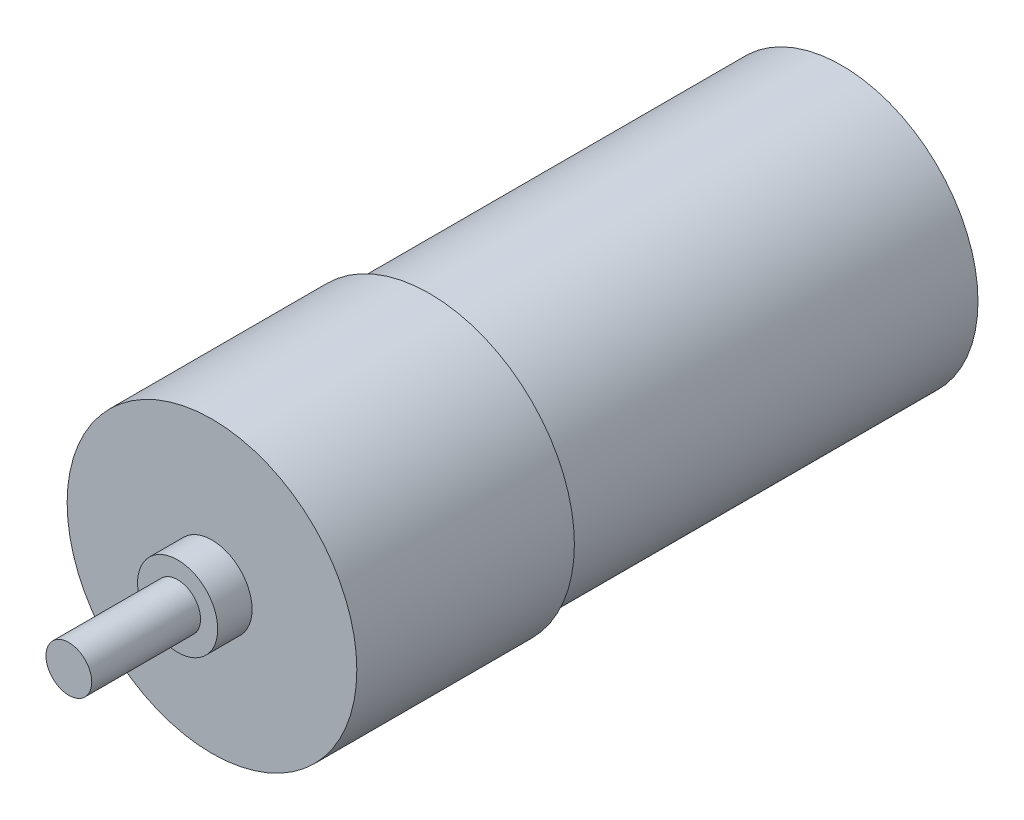
from build123d import *

# Parameters (mm, degrees)
SKETCH1_R           = 11.9
BOSS_EXTRUDE1_DEPTH = 36
SKETCH2_R           = 12.65
BOSS_EXTRUDE2_DEPTH = 19
SKETCH3_R           = 3.5
BOSS_EXTRUDE3_DEPTH = 3
SKETCH4_R           = 2
BOSS_EXTRUDE4_DEPTH = 9.5


with BuildPart() as part:
    # Sketch1 → Boss-Extrude1 (new body)
    with BuildSketch(Plane.XY):
        Circle(SKETCH1_R)
    extrude(amount=BOSS_EXTRUDE1_DEPTH)

    # Sketch2 → Boss-Extrude2 (add)
    with BuildSketch(Plane.XY.offset(36)):
        Circle(SKETCH2_R)
    extrude(amount=BOSS_EXTRUDE2_DEPTH)

    # Sketch3 → Boss-Extrude3 (add)
    with BuildSketch(Plane.XY.offset(55)):
        Circle(SKETCH3_R)
    extrude(amount=BOSS_EXTRUDE3_DEPTH)

    # Sketch4 → Boss-Extrude4 (add)
    with BuildSketch(Plane.XY.offset(58)):
        Circle(SKETCH4_R)
    extrude(amount=BOSS_EXTRUDE4_DEPTH)


solid = part.part
